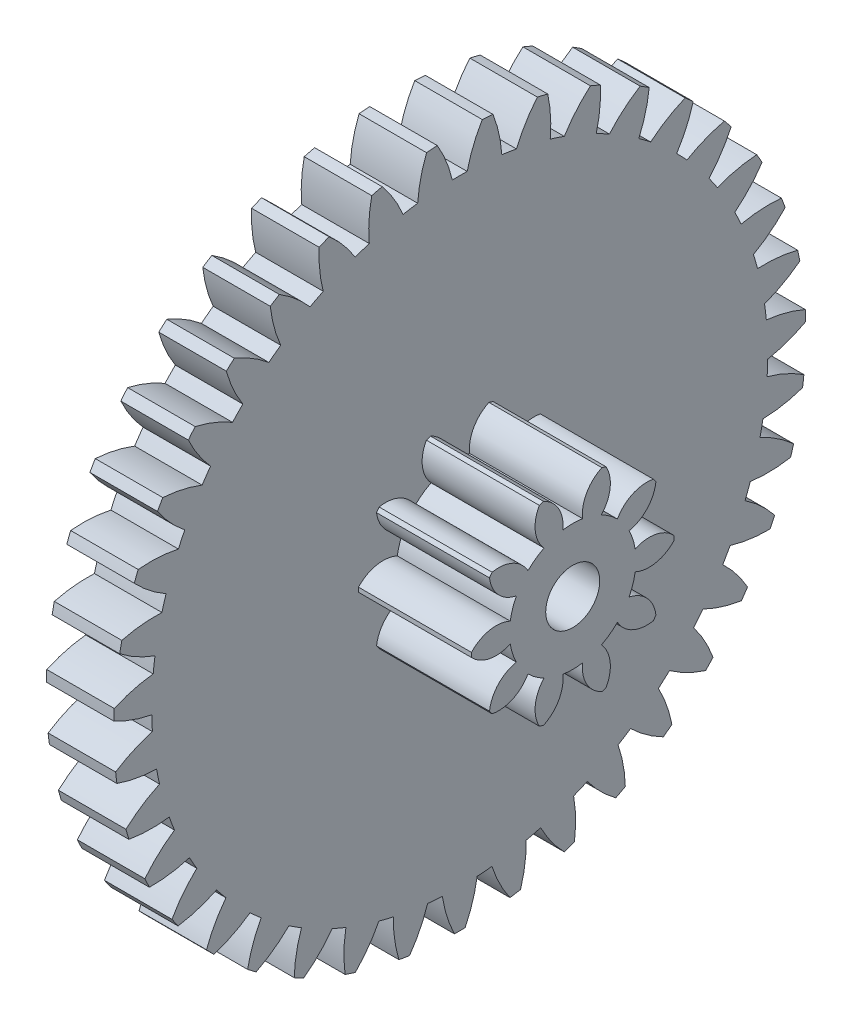
from build123d import *

# Parameters (mm, degrees)
ESQUISSE1_W                     = 1
ESQUISSE1_H                     = 5.125
ENL_V_MAT_EXTRU_1_DEPTH         = 8.316505313
ENL_V_MAT_EXTRU_2_DEPTH         = 8.316505313
ENL_V_MAT_EXTRU_3_DEPTH         = 8.316505313
ENL_V_MAT_EXTRU_4_DEPTH         = 8.316505313
ENL_V_MAT_EXTRU_5_DEPTH         = 8.316505313
ENL_V_MAT_EXTRU_6_DEPTH         = 8.316505313
ENL_V_MAT_EXTRU_7_DEPTH         = 8.316505313
ENL_V_MAT_EXTRU_8_DEPTH         = 8.316505313
ENL_V_MAT_EXTRU_9_DEPTH         = 8.316505313
ENL_V_MAT_EXTRU_10_DEPTH        = 8.316505313
ENL_V_MAT_EXTRU_11_DEPTH        = 8.316505313
ENL_V_MAT_EXTRU_12_DEPTH        = 8.316505313
ENL_V_MAT_EXTRU_13_DEPTH        = 8.316505313
ENL_V_MAT_EXTRU_14_DEPTH        = 8.316505313
ENL_V_MAT_EXTRU_15_DEPTH        = 8.316505313
ENL_V_MAT_EXTRU_16_DEPTH        = 8.316505313
ENL_V_MAT_EXTRU_17_DEPTH        = 8.316505313
ENL_V_MAT_EXTRU_18_DEPTH        = 8.316505313
ENL_V_MAT_EXTRU_19_DEPTH        = 8.316505313
ENL_V_MAT_EXTRU_20_DEPTH        = 8.316505313
ENL_V_MAT_EXTRU_21_DEPTH        = 8.316505313
ENL_V_MAT_EXTRU_22_DEPTH        = 8.316505313
ENL_V_MAT_EXTRU_23_DEPTH        = 8.316505313
ENL_V_MAT_EXTRU_24_DEPTH        = 8.316505313
ENL_V_MAT_EXTRU_25_DEPTH        = 8.316505313
ENL_V_MAT_EXTRU_26_DEPTH        = 8.316505313
ENL_V_MAT_EXTRU_27_DEPTH        = 8.316505313
ENL_V_MAT_EXTRU_28_DEPTH        = 8.316505313
ENL_V_MAT_EXTRU_29_DEPTH        = 8.316505313
ENL_V_MAT_EXTRU_30_DEPTH        = 8.316505313
ENL_V_MAT_EXTRU_31_DEPTH        = 8.316505313
ENL_V_MAT_EXTRU_32_DEPTH        = 8.315404959
ENL_V_MAT_EXTRU_33_DEPTH        = 8.315404959
ENL_V_MAT_EXTRU_34_DEPTH        = 8.315404959
ENL_V_MAT_EXTRU_35_DEPTH        = 8.315404959
ENL_V_MAT_EXTRU_36_DEPTH        = 8.315404959
ENL_V_MAT_EXTRU_37_DEPTH        = 8.315404959
ENL_V_MAT_EXTRU_38_DEPTH        = 8.315404959
ENL_V_MAT_EXTRU_39_DEPTH        = 8.315404959
BOSS_EXTRU_1_DEPTH              = 1.672761457
DIAM_TRE_DU_PER_AGE_0_8_0_8_1_D = 0.8


with BuildPart() as part:
    # Esquisse1 → Révolution1 (revolve)
    with BuildSketch(Plane(origin=(0, 0, 0), x_dir=(-1, 0, 0), z_dir=(0, 0, -1)), mode=Mode.PRIVATE) as r_volution1_sk:
        with Locations((-0.5, 2.5625)):
            Rectangle(ESQUISSE1_W, ESQUISSE1_H)
    revolve(r_volution1_sk.sketch.rotate(Axis((1, 0, 0), (-1, 0, 0)), 270), axis=Axis((1, 0, 0), (-1, 0, 0)))

    # Esquisse2 → Enlèv. mat.-Extru.1 (cut, through all)
    with BuildSketch(Plane.ZY):
        with BuildLine():
            ThreePointArc((-0.491599352, 5.101367961), (-0.822107814, 5.058632596), (-1.149140058, 4.994507196))
            ThreePointArc((-1.149140058, 4.994507196), (-0.974871828, 4.75090918), (-0.839964848, 4.483496549))
            ThreePointArc((-0.839964848, 4.483496549), (-0.731716058, 4.502429773), (-0.623042589, 4.518749847))
            ThreePointArc((-0.623042589, 4.518749847), (-0.579759423, 4.815121196), (-0.491599352, 5.101367961))
        make_face()
    extrude(amount=-ENL_V_MAT_EXTRU_1_DEPTH, mode=Mode.SUBTRACT)

    # Esquisse3 → Enlèv. mat.-Extru.2 (cut, through all)
    with BuildSketch(Plane.ZY):
        with BuildLine():
            ThreePointArc((0.3330837, 5.114164668), (0, 5.125), (-0.3330837, 5.114164668))
            ThreePointArc((-0.3330837, 5.114164668), (-0.200148067, 4.845766593), (-0.1098841, 4.560176283))
            ThreePointArc((-0.1098841, 4.560176283), (0, 4.5615), (0.1098841, 4.560176283))
            ThreePointArc((0.1098841, 4.560176283), (0.200148067, 4.845766593), (0.3330837, 5.114164668))
        make_face()
    extrude(amount=-ENL_V_MAT_EXTRU_2_DEPTH, mode=Mode.SUBTRACT)

    # Esquisse4 → Enlèv. mat.-Extru.3 (cut, through all)
    with BuildSketch(Plane.ZY):
        with BuildLine():
            ThreePointArc((1.149140058, 4.994507196), (0.822107814, 5.058632596), (0.491599352, 5.101367961))
            ThreePointArc((0.491599352, 5.101367961), (0.579759423, 4.815121196), (0.623042589, 4.518749847))
            ThreePointArc((0.623042589, 4.518749847), (0.731716058, 4.502429773), (0.839964848, 4.483496549))
            ThreePointArc((0.839964848, 4.483496549), (0.974871828, 4.75090918), (1.149140058, 4.994507196))
        make_face()
    extrude(amount=-ENL_V_MAT_EXTRU_3_DEPTH, mode=Mode.SUBTRACT)

    # Esquisse5 → Enlèv. mat.-Extru.4 (cut, through all)
    with BuildSketch(Plane.ZY):
        with BuildLine():
            ThreePointArc((1.935434293, 4.745494611), (1.622923468, 4.861249265), (1.303550238, 4.956448504))
            ThreePointArc((1.303550238, 4.956448504), (1.34465145, 4.65976669), (1.339832802, 4.360290164))
            ThreePointArc((1.339832802, 4.360290164), (1.444481054, 4.32674898), (1.548290948, 4.290696609))
            ThreePointArc((1.548290948, 4.290696609), (1.724346921, 4.533005716), (1.935434293, 4.745494611))
        make_face()
    extrude(amount=-ENL_V_MAT_EXTRU_4_DEPTH, mode=Mode.SUBTRACT)

    # Esquisse6 → Enlèv. mat.-Extru.5 (cut, through all)
    with BuildSketch(Plane.ZY):
        with BuildLine():
            ThreePointArc((2.671601796, 4.373576208), (2.381706257, 4.537962131), (2.081739858, 4.683159635))
            ThreePointArc((2.081739858, 4.683159635), (2.07471771, 4.383726673), (2.021922049, 4.088901256))
            ThreePointArc((2.021922049, 4.088901256), (2.119834749, 4.039007661), (2.216517126, 3.986769881))
            ThreePointArc((2.216517126, 3.986769881), (2.429162334, 4.197699784), (2.671601796, 4.373576208))
        make_face()
    extrude(amount=-ENL_V_MAT_EXTRU_5_DEPTH, mode=Mode.SUBTRACT)

    # Esquisse7 → Enlèv. mat.-Extru.6 (cut, through all)
    with BuildSketch(Plane.ZY):
        with BuildLine():
            ThreePointArc((3.338576216, 3.888384478), (3.078804104, 4.097144162), (2.806013509, 4.28857939))
            ThreePointArc((2.806013509, 4.28857939), (2.751049871, 3.994150439), (2.651644577, 3.711611952))
            ThreePointArc((2.651644577, 3.711611952), (2.740285838, 3.646658165), (2.827336674, 3.579587907))
            ThreePointArc((2.827336674, 3.579587907), (3.071063719, 3.753675633), (3.338576216, 3.888384478))
        make_face()
    extrude(amount=-ENL_V_MAT_EXTRU_6_DEPTH, mode=Mode.SUBTRACT)

    # Esquisse8 → Enlèv. mat.-Extru.7 (cut, through all)
    with BuildSketch(Plane.ZY):
        with BuildLine():
            ThreePointArc((3.919083265, 3.302485634), (3.696162543, 3.550212312), (3.457612884, 3.782927193))
            ThreePointArc((3.457612884, 3.782927193), (3.356131286, 3.501127806), (3.212690904, 3.23819385))
            ThreePointArc((3.212690904, 3.23819385), (3.289764964, 3.159862139), (3.364929688, 3.079696486))
            ThreePointArc((3.364929688, 3.079696486), (3.633426167, 3.212433254), (3.919083265, 3.302485634))
        make_face()
    extrude(amount=-ENL_V_MAT_EXTRU_7_DEPTH, mode=Mode.SUBTRACT)

    # Esquisse9 → Enlèv. mat.-Extru.8 (cut, through all)
    with BuildSketch(Plane.ZY):
        with BuildLine():
            ThreePointArc((4.398088117, 2.631054146), (4.217792313, 2.911331827), (4.019661902, 3.179299168))
            ThreePointArc((4.019661902, 3.179299168), (3.874290663, 2.917427803), (3.690530223, 2.680908227))
            ThreePointArc((3.690530223, 2.680908227), (3.754040904, 2.591227342), (3.81537279, 2.500042544))
            ThreePointArc((3.81537279, 2.500042544), (4.101684785, 2.587990542), (4.398088117, 2.631054146))
        make_face()
    extrude(amount=-ENL_V_MAT_EXTRU_8_DEPTH, mode=Mode.SUBTRACT)

    # Esquisse10 → Enlèv. mat.-Extru.9 (cut, through all)
    with BuildSketch(Plane.ZY):
        with BuildLine():
            ThreePointArc((4.763184796, 1.891479738), (4.630183477, 2.197049377), (4.477603787, 2.493328964))
            ThreePointArc((4.477603787, 2.493328964), (4.292107947, 2.258167951), (4.072786749, 2.054188489))
            ThreePointArc((4.072786749, 2.054188489), (4.121089157, 1.955481119), (4.166999741, 1.855638814))
            ThreePointArc((4.166999741, 1.855638814), (4.463711922, 1.896520234), (4.763184796, 1.891479738))
        make_face()
    extrude(amount=-ENL_V_MAT_EXTRU_9_DEPTH, mode=Mode.SUBTRACT)

    # Esquisse11 → Enlèv. mat.-Extru.10 (cut, through all)
    with BuildSketch(Plane.ZY):
        with BuildLine():
            ThreePointArc((5.004917491, 1.102916998), (4.922655322, 1.425864503), (4.819578087, 1.74278285))
            ThreePointArc((4.819578087, 1.74278285), (4.59876189, 1.540422736), (4.349560237, 1.374266349))
            ThreePointArc((4.349560237, 1.374266349), (4.381403366, 1.269088962), (4.410703588, 1.163175012))
            ThreePointArc((4.410703588, 1.163175012), (4.710131265, 1.155931048), (5.004917491, 1.102916998))
        make_face()
    extrude(amount=-ENL_V_MAT_EXTRU_10_DEPTH, mode=Mode.SUBTRACT)

    # Esquisse12 → Enlèv. mat.-Extru.11 (cut, through all)
    with BuildSketch(Plane.ZY):
        with BuildLine():
            ThreePointArc((5.117025453, 0.285789287), (5.08763298, 0.617750486), (5.036727846, 0.947099576))
            ThreePointArc((5.036727846, 0.947099576), (4.786310315, 0.782781381), (4.513682399, 0.658751432))
            ThreePointArc((4.513682399, 0.658751432), (4.528241529, 0.549828067), (4.540172528, 0.440585589))
            ThreePointArc((4.540172528, 0.440585589), (4.834560682, 0.385403856), (5.117025453, 0.285789287))
        make_face()
    extrude(amount=-ENL_V_MAT_EXTRU_11_DEPTH, mode=Mode.SUBTRACT)

    # Esquisse13 → Enlèv. mat.-Extru.12 (cut, through all)
    with BuildSketch(Plane.ZY):
        with BuildLine():
            ThreePointArc((5.096605143, -0.538740217), (5.120843616, -0.206362943), (5.123428999, 0.12688692))
            ThreePointArc((5.123428999, 0.12688692), (4.849895818, 0.0048664), (4.560902559, -0.073824801))
            ThreePointArc((4.560902559, -0.073824801), (4.557800615, -0.183673086), (4.552053385, -0.293414769))
            ThreePointArc((4.552053385, -0.293414769), (4.833777517, -0.395105094), (5.096605143, -0.538740217))
        make_face()
    extrude(amount=-ENL_V_MAT_EXTRU_12_DEPTH, mode=Mode.SUBTRACT)

    # Esquisse14 → Enlèv. mat.-Extru.13 (cut, through all)
    with BuildSketch(Plane.ZY):
        with BuildLine():
            ThreePointArc((4.944185436, -1.349316631), (5.021427092, -1.025131681), (5.077436033, -0.69661204))
            ThreePointArc((5.077436033, -0.69661204), (4.787871566, -0.773174619), (4.489997737, -0.804489011))
            ThreePointArc((4.489997737, -0.804489011), (4.469315059, -0.912417202), (4.446038451, -1.019815839))
            ThreePointArc((4.446038451, -1.019815839), (4.707802054, -1.16538103), (4.944185436, -1.349316631))
        make_face()
    extrude(amount=-ENL_V_MAT_EXTRU_13_DEPTH, mode=Mode.SUBTRACT)

    # Esquisse15 → Enlèv. mat.-Extru.14 (cut, through all)
    with BuildSketch(Plane.ZY):
        with BuildLine():
            ThreePointArc((4.663713924, -2.124946454), (4.791958244, -1.817350046), (4.89994014, -1.502069115))
            ThreePointArc((4.89994014, -1.502069115), (4.601843956, -1.531190821), (4.302804333, -1.514317378))
            ThreePointArc((4.302804333, -1.514317378), (4.265076591, -1.617530192), (4.224873456, -1.719804214))
            ThreePointArc((4.224873456, -1.719804214), (4.45989699, -1.905474209), (4.663713924, -2.124946454))
        make_face()
    extrude(amount=-ENL_V_MAT_EXTRU_14_DEPTH, mode=Mode.SUBTRACT)

    # Esquisse16 → Enlèv. mat.-Extru.15 (cut, through all)
    with BuildSketch(Plane.ZY):
        with BuildLine():
            ThreePointArc((4.262454672, -2.845541279), (4.438380194, -2.5625), (4.595538371, -2.268623388))
            ThreePointArc((4.595538371, -2.268623388), (4.296631004, -2.249549986), (4.004170557, -2.18492572))
            ThreePointArc((4.004170557, -2.18492572), (3.950374879, -2.28075), (3.894286457, -2.375250564))
            ThreePointArc((3.894286457, -2.375250564), (4.096482937, -2.596216607), (4.262454672, -2.845541279))
        make_face()
    extrude(amount=-ENL_V_MAT_EXTRU_15_DEPTH, mode=Mode.SUBTRACT)

    # Esquisse17 → Enlèv. mat.-Extru.16 (cut, through all)
    with BuildSketch(Plane.ZY):
        with BuildLine():
            ThreePointArc((3.750800082, -3.492438081), (3.969850429, -3.24128255), (4.172114573, -2.976421508))
            ThreePointArc((4.172114573, -2.976421508), (3.880137567, -2.909646987), (3.601830867, -2.798945633))
            ThreePointArc((3.601830867, -2.798945633), (3.533360533, -2.884899581), (3.462839485, -2.969179171))
            ThreePointArc((3.462839485, -2.969179171), (3.626972127, -3.219718359), (3.750800082, -3.492438081))
        make_face()
    extrude(amount=-ENL_V_MAT_EXTRU_16_DEPTH, mode=Mode.SUBTRACT)

    # Esquisse18 → Enlèv. mat.-Extru.17 (cut, through all)
    with BuildSketch(Plane.ZY):
        with BuildLine():
            ThreePointArc((3.14200174, -4.04888257), (3.398503623, -3.836117584), (3.640635198, -3.607131873))
            ThreePointArc((3.640635198, -3.607131873), (3.363150604, -3.49438566), (3.106205649, -3.340474325))
            ThreePointArc((3.106205649, -3.340474325), (3.024834006, -3.414331778), (2.941706789, -3.486207598))
            ThreePointArc((2.941706789, -3.486207598), (3.063524645, -3.759831097), (3.14200174, -4.04888257))
        make_face()
    extrude(amount=-ENL_V_MAT_EXTRU_17_DEPTH, mode=Mode.SUBTRACT)

    # Esquisse19 → Enlèv. mat.-Extru.18 (cut, through all)
    with BuildSketch(Plane.ZY):
        with BuildLine():
            ThreePointArc((2.451827203, -4.500463128), (2.739137359, -4.331599188), (3.014865285, -4.144419418))
            ThreePointArc((3.014865285, -4.144419418), (2.759059808, -3.988621579), (2.530131336, -3.795486487))
            ThreePointArc((2.530131336, -3.795486487), (2.437965866, -3.855334575), (2.344385433, -3.912945079))
            ThreePointArc((2.344385433, -3.912945079), (2.420733483, -4.202566184), (2.451827203, -4.500463128))
        make_face()
    extrude(amount=-ENL_V_MAT_EXTRU_18_DEPTH, mode=Mode.SUBTRACT)

    # Esquisse20 → Enlèv. mat.-Extru.19 (cut, through all)
    with BuildSketch(Plane.ZY):
        with BuildLine():
            ThreePointArc((1.69815163, -4.835484054), (2.008828876, -4.714894649), (2.311011944, -4.574368677))
            ThreePointArc((2.311011944, -4.574368677), (2.083510811, -4.379554295), (1.888527951, -4.152197542))
            ThreePointArc((1.888527951, -4.152197542), (1.787955691, -4.196486232), (1.686345725, -4.238339338))
            ThreePointArc((1.686345725, -4.238339338), (1.715246596, -4.536457014), (1.69815163, -4.835484054))
        make_face()
    extrude(amount=-ENL_V_MAT_EXTRU_19_DEPTH, mode=Mode.SUBTRACT)

    # Esquisse21 → Enlèv. mat.-Extru.20 (cut, through all)
    with BuildSketch(Plane.ZY):
        with BuildLine():
            ThreePointArc((0.900494822, -5.045268484), (1.226492779, -4.976076814), (1.547304608, -4.88584419))
            ThreePointArc((1.547304608, -4.88584419), (1.35399998, -4.657058855), (1.198012684, -4.401368862))
            ThreePointArc((1.198012684, -4.401368862), (1.091638403, -4.4289511), (0.984630549, -4.453962835))
            ThreePointArc((0.984630549, -4.453962835), (0.965335723, -4.75285599), (0.900494822, -5.045268484))
        make_face()
    extrude(amount=-ENL_V_MAT_EXTRU_20_DEPTH, mode=Mode.SUBTRACT)

    # Esquisse22 → Enlèv. mat.-Extru.21 (cut, through all)
    with BuildSketch(Plane.ZY):
        with BuildLine():
            ThreePointArc((0.079515671, -5.12438311), (0.412391165, -5.108381204), (0.743522895, -5.070778905))
            ThreePointArc((0.743522895, -5.070778905), (0.589421259, -4.813948037), (0.476469518, -4.53654704))
            ThreePointArc((0.476469518, -4.53654704), (0.367048253, -4.546708461), (0.257413959, -4.554231033))
            ThreePointArc((0.257413959, -4.554231033), (0.190423162, -4.846158493), (0.079515671, -5.12438311))
        make_face()
    extrude(amount=-ENL_V_MAT_EXTRU_21_DEPTH, mode=Mode.SUBTRACT)

    # Esquisse23 → Enlèv. mat.-Extru.22 (cut, through all)
    with BuildSketch(Plane.ZY):
        with BuildLine():
            ThreePointArc((-0.743522895, -5.070778905), (-0.412391165, -5.108381204), (-0.079515671, -5.12438311))
            ThreePointArc((-0.079515671, -5.12438311), (-0.190423162, -4.846158493), (-0.257413959, -4.554231033))
            ThreePointArc((-0.257413959, -4.554231033), (-0.367048253, -4.546708461), (-0.476469518, -4.53654704))
            ThreePointArc((-0.476469518, -4.53654704), (-0.589421259, -4.813948037), (-0.743522895, -5.070778905))
        make_face()
    extrude(amount=-ENL_V_MAT_EXTRU_22_DEPTH, mode=Mode.SUBTRACT)

    # Esquisse24 → Enlèv. mat.-Extru.23 (cut, through all)
    with BuildSketch(Plane.ZY):
        with BuildLine():
            ThreePointArc((-1.547304608, -4.88584419), (-1.226492779, -4.976076814), (-0.900494822, -5.045268484))
            ThreePointArc((-0.900494822, -5.045268484), (-0.965335723, -4.75285599), (-0.984630549, -4.453962835))
            ThreePointArc((-0.984630549, -4.453962835), (-1.091638403, -4.4289511), (-1.198012684, -4.401368862))
            ThreePointArc((-1.198012684, -4.401368862), (-1.35399998, -4.657058855), (-1.547304608, -4.88584419))
        make_face()
    extrude(amount=-ENL_V_MAT_EXTRU_23_DEPTH, mode=Mode.SUBTRACT)

    # Esquisse25 → Enlèv. mat.-Extru.24 (cut, through all)
    with BuildSketch(Plane.ZY):
        with BuildLine():
            ThreePointArc((-2.311011944, -4.574368677), (-2.008828876, -4.714894649), (-1.69815163, -4.835484054))
            ThreePointArc((-1.69815163, -4.835484054), (-1.715246596, -4.536457014), (-1.686345725, -4.238339338))
            ThreePointArc((-1.686345725, -4.238339338), (-1.787955691, -4.196486232), (-1.888527951, -4.152197542))
            ThreePointArc((-1.888527951, -4.152197542), (-2.083510811, -4.379554295), (-2.311011944, -4.574368677))
        make_face()
    extrude(amount=-ENL_V_MAT_EXTRU_24_DEPTH, mode=Mode.SUBTRACT)

    # Esquisse26 → Enlèv. mat.-Extru.25 (cut, through all)
    with BuildSketch(Plane.ZY):
        with BuildLine():
            ThreePointArc((-3.014865285, -4.144419418), (-2.739137359, -4.331599188), (-2.451827203, -4.500463128))
            ThreePointArc((-2.451827203, -4.500463128), (-2.420733483, -4.202566184), (-2.344385433, -3.912945079))
            ThreePointArc((-2.344385433, -3.912945079), (-2.437965866, -3.855334575), (-2.530131336, -3.795486487))
            ThreePointArc((-2.530131336, -3.795486487), (-2.759059808, -3.988621579), (-3.014865285, -4.144419418))
        make_face()
    extrude(amount=-ENL_V_MAT_EXTRU_25_DEPTH, mode=Mode.SUBTRACT)

    # Esquisse27 → Enlèv. mat.-Extru.26 (cut, through all)
    with BuildSketch(Plane.ZY):
        with BuildLine():
            ThreePointArc((-3.640635198, -3.607131873), (-3.398503623, -3.836117584), (-3.14200174, -4.04888257))
            ThreePointArc((-3.14200174, -4.04888257), (-3.063524645, -3.759831097), (-2.941706789, -3.486207598))
            ThreePointArc((-2.941706789, -3.486207598), (-3.024834006, -3.414331778), (-3.106205649, -3.340474325))
            ThreePointArc((-3.106205649, -3.340474325), (-3.363150604, -3.49438566), (-3.640635198, -3.607131873))
        make_face()
    extrude(amount=-ENL_V_MAT_EXTRU_26_DEPTH, mode=Mode.SUBTRACT)

    # Esquisse28 → Enlèv. mat.-Extru.27 (cut, through all)
    with BuildSketch(Plane.ZY):
        with BuildLine():
            ThreePointArc((-4.172114573, -2.976421508), (-3.969850429, -3.24128255), (-3.750800082, -3.492438081))
            ThreePointArc((-3.750800082, -3.492438081), (-3.626972127, -3.219718359), (-3.462839485, -2.969179171))
            ThreePointArc((-3.462839485, -2.969179171), (-3.533360533, -2.884899581), (-3.601830867, -2.798945633))
            ThreePointArc((-3.601830867, -2.798945633), (-3.880137567, -2.909646987), (-4.172114573, -2.976421508))
        make_face()
    extrude(amount=-ENL_V_MAT_EXTRU_27_DEPTH, mode=Mode.SUBTRACT)

    # Esquisse29 → Enlèv. mat.-Extru.28 (cut, through all)
    with BuildSketch(Plane.ZY):
        with BuildLine():
            ThreePointArc((-4.595538371, -2.268623388), (-4.438380194, -2.5625), (-4.262454672, -2.845541279))
            ThreePointArc((-4.262454672, -2.845541279), (-4.096482937, -2.596216607), (-3.894286457, -2.375250564))
            ThreePointArc((-3.894286457, -2.375250564), (-3.950374879, -2.28075), (-4.004170557, -2.18492572))
            ThreePointArc((-4.004170557, -2.18492572), (-4.296631004, -2.249549986), (-4.595538371, -2.268623388))
        make_face()
    extrude(amount=-ENL_V_MAT_EXTRU_28_DEPTH, mode=Mode.SUBTRACT)

    # Esquisse30 → Enlèv. mat.-Extru.29 (cut, through all)
    with BuildSketch(Plane.ZY):
        with BuildLine():
            ThreePointArc((-4.89994014, -1.502069115), (-4.791958244, -1.817350046), (-4.663713924, -2.124946454))
            ThreePointArc((-4.663713924, -2.124946454), (-4.45989699, -1.905474209), (-4.224873456, -1.719804214))
            ThreePointArc((-4.224873456, -1.719804214), (-4.265076591, -1.617530192), (-4.302804333, -1.514317378))
            ThreePointArc((-4.302804333, -1.514317378), (-4.601843956, -1.531190821), (-4.89994014, -1.502069115))
        make_face()
    extrude(amount=-ENL_V_MAT_EXTRU_29_DEPTH, mode=Mode.SUBTRACT)

    # Esquisse31 → Enlèv. mat.-Extru.30 (cut, through all)
    with BuildSketch(Plane.ZY):
        with BuildLine():
            ThreePointArc((-5.077436033, -0.69661204), (-5.021427092, -1.025131681), (-4.944185436, -1.349316631))
            ThreePointArc((-4.944185436, -1.349316631), (-4.707802054, -1.16538103), (-4.446038451, -1.019815839))
            ThreePointArc((-4.446038451, -1.019815839), (-4.469315059, -0.912417202), (-4.489997737, -0.804489011))
            ThreePointArc((-4.489997737, -0.804489011), (-4.787871566, -0.773174619), (-5.077436033, -0.69661204))
        make_face()
    extrude(amount=-ENL_V_MAT_EXTRU_30_DEPTH, mode=Mode.SUBTRACT)

    # Esquisse32 → Enlèv. mat.-Extru.31 (cut, through all)
    with BuildSketch(Plane.ZY):
        with BuildLine():
            ThreePointArc((-5.123428999, 0.12688692), (-5.120843616, -0.206362943), (-5.096605143, -0.538740217))
            ThreePointArc((-5.096605143, -0.538740217), (-4.833777517, -0.395105094), (-4.552053385, -0.293414769))
            ThreePointArc((-4.552053385, -0.293414769), (-4.557800615, -0.183673086), (-4.560902559, -0.073824801))
            ThreePointArc((-4.560902559, -0.073824801), (-4.849895818, 0.0048664), (-5.123428999, 0.12688692))
        make_face()
    extrude(amount=-ENL_V_MAT_EXTRU_31_DEPTH, mode=Mode.SUBTRACT)

    # Esquisse33 → Enlèv. mat.-Extru.32 (cut, through all)
    with BuildSketch(Plane.ZY):
        with BuildLine():
            ThreePointArc((-5.036727846, 0.947099576), (-5.08763298, 0.617750486), (-5.117025453, 0.285789287))
            ThreePointArc((-5.117025453, 0.285789287), (-4.834560682, 0.385403856), (-4.540172528, 0.440585589))
            ThreePointArc((-4.540172528, 0.440585589), (-4.528241529, 0.549828067), (-4.513682399, 0.658751432))
            ThreePointArc((-4.513682399, 0.658751432), (-4.786310315, 0.782781381), (-5.036727846, 0.947099576))
        make_face()
    extrude(amount=-ENL_V_MAT_EXTRU_32_DEPTH, mode=Mode.SUBTRACT)

    # Esquisse34 → Enlèv. mat.-Extru.33 (cut, through all)
    with BuildSketch(Plane.ZY):
        with BuildLine():
            ThreePointArc((-4.819578087, 1.74278285), (-4.922655322, 1.425864503), (-5.004917491, 1.102916998))
            ThreePointArc((-5.004917491, 1.102916998), (-4.710131265, 1.155931048), (-4.410703588, 1.163175012))
            ThreePointArc((-4.410703588, 1.163175012), (-4.381403366, 1.269088962), (-4.349560237, 1.374266349))
            ThreePointArc((-4.349560237, 1.374266349), (-4.59876189, 1.540422736), (-4.819578087, 1.74278285))
        make_face()
    extrude(amount=-ENL_V_MAT_EXTRU_33_DEPTH, mode=Mode.SUBTRACT)

    # Esquisse35 → Enlèv. mat.-Extru.34 (cut, through all)
    with BuildSketch(Plane.ZY):
        with BuildLine():
            ThreePointArc((-4.477603787, 2.493328964), (-4.630183477, 2.197049377), (-4.763184796, 1.891479738))
            ThreePointArc((-4.763184796, 1.891479738), (-4.463711922, 1.896520234), (-4.166999741, 1.855638814))
            ThreePointArc((-4.166999741, 1.855638814), (-4.121089157, 1.955481119), (-4.072786749, 2.054188489))
            ThreePointArc((-4.072786749, 2.054188489), (-4.292107947, 2.258167951), (-4.477603787, 2.493328964))
        make_face()
    extrude(amount=-ENL_V_MAT_EXTRU_34_DEPTH, mode=Mode.SUBTRACT)

    # Esquisse36 → Enlèv. mat.-Extru.35 (cut, through all)
    with BuildSketch(Plane.ZY):
        with BuildLine():
            ThreePointArc((-4.019661902, 3.179299168), (-4.217792313, 2.911331827), (-4.398088117, 2.631054146))
            ThreePointArc((-4.398088117, 2.631054146), (-4.101684785, 2.587990542), (-3.81537279, 2.500042544))
            ThreePointArc((-3.81537279, 2.500042544), (-3.754040904, 2.591227342), (-3.690530223, 2.680908227))
            ThreePointArc((-3.690530223, 2.680908227), (-3.874290663, 2.917427803), (-4.019661902, 3.179299168))
        make_face()
    extrude(amount=-ENL_V_MAT_EXTRU_35_DEPTH, mode=Mode.SUBTRACT)

    # Esquisse37 → Enlèv. mat.-Extru.36 (cut, through all)
    with BuildSketch(Plane.ZY):
        with BuildLine():
            ThreePointArc((-3.457612884, 3.782927193), (-3.696162543, 3.550212312), (-3.919083265, 3.302485634))
            ThreePointArc((-3.919083265, 3.302485634), (-3.633426167, 3.212433254), (-3.364929688, 3.079696486))
            ThreePointArc((-3.364929688, 3.079696486), (-3.289764964, 3.159862139), (-3.212690904, 3.23819385))
            ThreePointArc((-3.212690904, 3.23819385), (-3.356131286, 3.501127806), (-3.457612884, 3.782927193))
        make_face()
    extrude(amount=-ENL_V_MAT_EXTRU_36_DEPTH, mode=Mode.SUBTRACT)

    # Esquisse38 → Enlèv. mat.-Extru.37 (cut, through all)
    with BuildSketch(Plane.ZY):
        with BuildLine():
            ThreePointArc((-2.806013509, 4.28857939), (-3.078804104, 4.097144162), (-3.338576216, 3.888384478))
            ThreePointArc((-3.338576216, 3.888384478), (-3.071063719, 3.753675633), (-2.827336674, 3.579587907))
            ThreePointArc((-2.827336674, 3.579587907), (-2.740285838, 3.646658165), (-2.651644577, 3.711611952))
            ThreePointArc((-2.651644577, 3.711611952), (-2.751049871, 3.994150439), (-2.806013509, 4.28857939))
        make_face()
    extrude(amount=-ENL_V_MAT_EXTRU_37_DEPTH, mode=Mode.SUBTRACT)

    # Esquisse39 → Enlèv. mat.-Extru.38 (cut, through all)
    with BuildSketch(Plane.ZY):
        with BuildLine():
            ThreePointArc((-2.081739858, 4.683159635), (-2.381706257, 4.537962131), (-2.671601796, 4.373576208))
            ThreePointArc((-2.671601796, 4.373576208), (-2.429162334, 4.197699784), (-2.216517126, 3.986769881))
            ThreePointArc((-2.216517126, 3.986769881), (-2.119834749, 4.039007661), (-2.021922049, 4.088901256))
            ThreePointArc((-2.021922049, 4.088901256), (-2.07471771, 4.383726673), (-2.081739858, 4.683159635))
        make_face()
    extrude(amount=-ENL_V_MAT_EXTRU_38_DEPTH, mode=Mode.SUBTRACT)

    # Esquisse40 → Enlèv. mat.-Extru.39 (cut, through all)
    with BuildSketch(Plane.ZY):
        with BuildLine():
            ThreePointArc((-1.303550238, 4.956448504), (-1.622923468, 4.861249265), (-1.935434293, 4.745494611))
            ThreePointArc((-1.935434293, 4.745494611), (-1.724346921, 4.533005716), (-1.548290948, 4.290696609))
            ThreePointArc((-1.548290948, 4.290696609), (-1.444481054, 4.32674898), (-1.339832802, 4.360290164))
            ThreePointArc((-1.339832802, 4.360290164), (-1.34465145, 4.65976669), (-1.303550238, 4.956448504))
        make_face()
    extrude(amount=-ENL_V_MAT_EXTRU_39_DEPTH, mode=Mode.SUBTRACT)

    # Esquisse41 → Boss.-Extru.1 (add)
    with BuildSketch(Plane(origin=(1, 0, 0), x_dir=(0, 0, -1), z_dir=(1, 0, 0))):
        with BuildLine():
            ThreePointArc((0.662076845, 0.662334131), (0.888221597, 0.871258232), (1.193891961, 0.908086992))
            ThreePointArc((1.193891961, 0.908086992), (1.213525492, 0.881677878), (1.232574957, 0.854844416))
            ThreePointArc((1.232574957, 0.854844416), (1.103091387, 0.575515338), (0.834510188, 0.424999995))
            ThreePointArc((0.834510188, 0.424999995), (0.890664428, 0.289394415), (0.924941654, 0.146680563))
            ThreePointArc((0.924941654, 0.146680563), (1.230699107, 0.18277916), (1.499639028, 0.032905721))
            ThreePointArc((1.499639028, 0.032905721), (1.5, 0), (1.499639028, -0.032905721))
            ThreePointArc((1.499639028, -0.032905721), (1.230699107, -0.18277916), (0.924941654, -0.146680563))
            ThreePointArc((0.924941654, -0.146680563), (0.890664428, -0.289394415), (0.834510188, -0.424999995))
            ThreePointArc((0.834510188, -0.424999995), (1.103091387, -0.575515338), (1.232574957, -0.854844416))
            ThreePointArc((1.232574957, -0.854844416), (1.213525492, -0.881677878), (1.193891961, -0.908086992))
            ThreePointArc((1.193891961, -0.908086992), (0.888221597, -0.871258232), (0.662076845, -0.662334131))
            ThreePointArc((0.662076845, -0.662334131), (0.550460889, -0.757644415), (0.425324195, -0.834345))
            ThreePointArc((0.425324195, -0.834345), (0.55414025, -1.113982538), (0.494709146, -1.416073042))
            ThreePointArc((0.494709146, -1.416073042), (0.463525492, -1.426584774), (0.432118744, -1.436409897))
            ThreePointArc((0.432118744, -1.436409897), (0.206473627, -1.226946272), (0.146321185, -0.924998573))
            ThreePointArc((0.146321185, -0.924998573), (0, -0.9365), (-0.146321185, -0.924998573))
            ThreePointArc((-0.146321185, -0.924998573), (-0.206473627, -1.226946272), (-0.432118744, -1.436409897))
            ThreePointArc((-0.432118744, -1.436409897), (-0.463525492, -1.426584774), (-0.494709146, -1.416073042))
            ThreePointArc((-0.494709146, -1.416073042), (-0.55414025, -1.113982538), (-0.425324195, -0.834345))
            ThreePointArc((-0.425324195, -0.834345), (-0.550460889, -0.757644415), (-0.662076845, -0.662334131))
            ThreePointArc((-0.662076845, -0.662334131), (-0.888221597, -0.871258232), (-1.193891961, -0.908086992))
            ThreePointArc((-1.193891961, -0.908086992), (-1.213525492, -0.881677878), (-1.232574957, -0.854844416))
            ThreePointArc((-1.232574957, -0.854844416), (-1.103091387, -0.575515338), (-0.834510188, -0.424999995))
            ThreePointArc((-0.834510188, -0.424999995), (-0.890664428, -0.289394415), (-0.924941654, -0.146680563))
            ThreePointArc((-0.924941654, -0.146680563), (-1.230699107, -0.18277916), (-1.499639028, -0.032905721))
            ThreePointArc((-1.499639028, -0.032905721), (-1.5, 0), (-1.499639028, 0.032905721))
            ThreePointArc((-1.499639028, 0.032905721), (-1.230699107, 0.18277916), (-0.924941654, 0.146680563))
            ThreePointArc((-0.924941654, 0.146680563), (-0.890664428, 0.289394415), (-0.834510188, 0.424999995))
            ThreePointArc((-0.834510188, 0.424999995), (-1.103091387, 0.575515338), (-1.232574957, 0.854844416))
            ThreePointArc((-1.232574957, 0.854844416), (-1.213525492, 0.881677878), (-1.193891961, 0.908086992))
            ThreePointArc((-1.193891961, 0.908086992), (-0.888221597, 0.871258232), (-0.662076845, 0.662334131))
            ThreePointArc((-0.662076845, 0.662334131), (-0.550460889, 0.757644415), (-0.425324195, 0.834345))
            ThreePointArc((-0.425324195, 0.834345), (-0.55414025, 1.113982538), (-0.494709146, 1.416073042))
            ThreePointArc((-0.494709146, 1.416073042), (-0.463525492, 1.426584774), (-0.432118744, 1.436409897))
            ThreePointArc((-0.432118744, 1.436409897), (-0.206473627, 1.226946272), (-0.146321185, 0.924998573))
            ThreePointArc((-0.146321185, 0.924998573), (0, 0.9365), (0.146321185, 0.924998573))
            ThreePointArc((0.146321185, 0.924998573), (0.206473627, 1.226946272), (0.432118744, 1.436409897))
            ThreePointArc((0.432118744, 1.436409897), (0.463525492, 1.426584774), (0.494709146, 1.416073042))
            ThreePointArc((0.494709146, 1.416073042), (0.55414025, 1.113982538), (0.425324195, 0.834345))
            ThreePointArc((0.425324195, 0.834345), (0.550460889, 0.757644415), (0.662076845, 0.662334131))
        make_face()
    extrude(amount=BOSS_EXTRU_1_DEPTH)

    # Diamètre du perçage Ø0.8 (0.8)1 (through all)
    with Locations(Plane.ZY):
        with Locations((0, 0)):
            Hole(DIAM_TRE_DU_PER_AGE_0_8_0_8_1_D / 2)


solid = part.part
